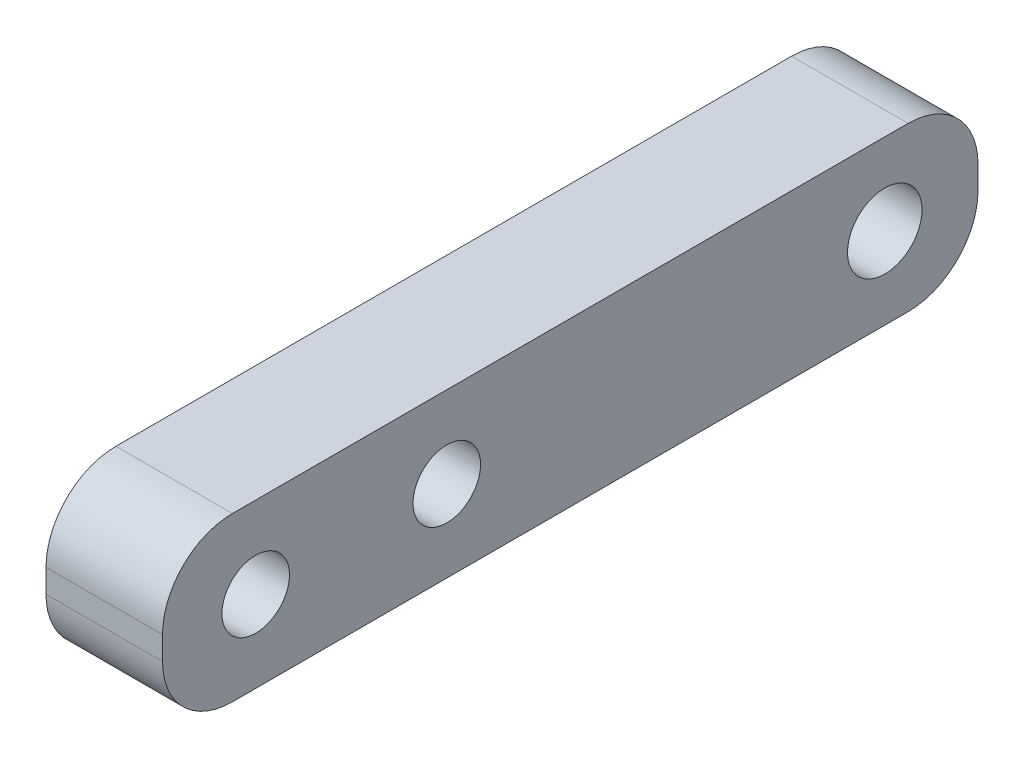
from build123d import *

# Parameters (mm, degrees)
SKETCH1_W           = 35
SKETCH1_H           = 7
BOSS_EXTRUDE1_DEPTH = 5
SKETCH2_R           = 1.45
SKETCH2_R_2         = 1.6
CUT_EXTRUDE1_DEPTH  = 37.041642582
FILLET1_R           = 3


with BuildPart() as part:
    # Sketch1 → Boss-Extrude1 (new body)
    with BuildSketch(Plane(origin=(0, 0, 0), x_dir=(0, 0, -1), z_dir=(1, 0, 0))):
        with Locations((17.5, -3.5)):
            Rectangle(SKETCH1_W, SKETCH1_H)
    extrude(amount=BOSS_EXTRUDE1_DEPTH)

    # Sketch2 → Cut-Extrude1 (cut, through all)
    with BuildSketch(Plane(origin=(5, 0, 0), x_dir=(0, 0, -1), z_dir=(1, 0, 0))):
        with Locations((4, -3.5)):
            Circle(SKETCH2_R)
        with Locations((12.2, -3.5)):
            Circle(SKETCH2_R)
        with Locations((31, -3.5)):
            Circle(SKETCH2_R_2)
    extrude(amount=-CUT_EXTRUDE1_DEPTH, mode=Mode.SUBTRACT)

    # Fillet1
    fillet1_edges = [part.edges().sort_by_distance(p)[0] for p in [
        (2.5, 0, 0),
        (2.5, 0, -35),
        (2.5, -7, -35),
        (2.5, -7, 0),
    ]]
    fillet(fillet1_edges, radius=FILLET1_R)


solid = part.part
